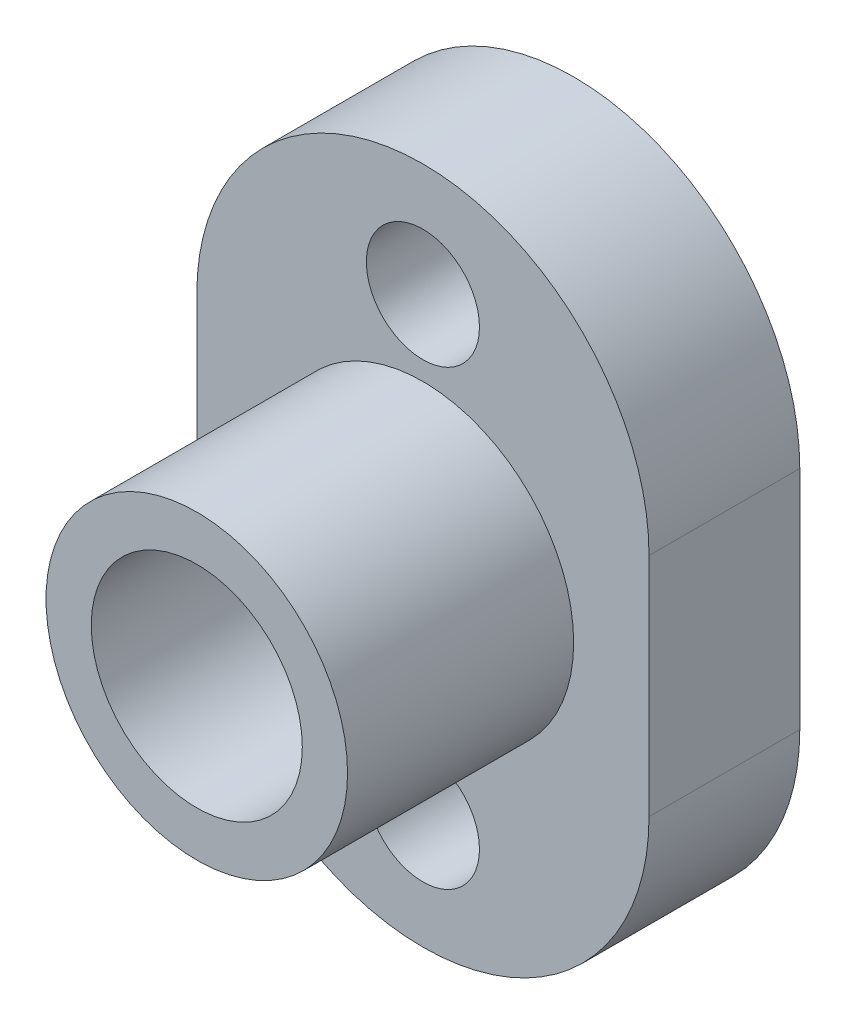
from build123d import *

# Parameters (mm, degrees)
SKETCH3_R           = 1.5
SKETCH3_R_2         = 2.8
BOSS_EXTRUDE1_DEPTH = 4
SKETCH3_3_R         = 4
SKETCH3_3_R_2       = 2.8
BOSS_EXTRUDE2_DEPTH = 10


with BuildPart() as part:
    # Sketch3 → Boss-Extrude1 (new body)
    with BuildSketch(Plane.XY):
        with BuildLine():
            Line((-6, 3), (-6, -3))
            ThreePointArc((-6, -3), (0, -9), (6, -3))
            Line((6, -3), (6, 3))
            ThreePointArc((6, 3), (0, 9), (-6, 3))
        make_face()
        with Locations((0, 6)):
            Circle(SKETCH3_R, mode=Mode.SUBTRACT)
        with Locations((0, -6)):
            Circle(SKETCH3_R, mode=Mode.SUBTRACT)
        Circle(SKETCH3_R_2, mode=Mode.SUBTRACT)
    extrude(amount=BOSS_EXTRUDE1_DEPTH)

    # Sketch3<3> → Boss-Extrude2 (add)
    with BuildSketch(Plane.XY):
        Circle(SKETCH3_3_R)
        Circle(SKETCH3_3_R_2, mode=Mode.SUBTRACT)
    extrude(amount=BOSS_EXTRUDE2_DEPTH)


solid = part.part
